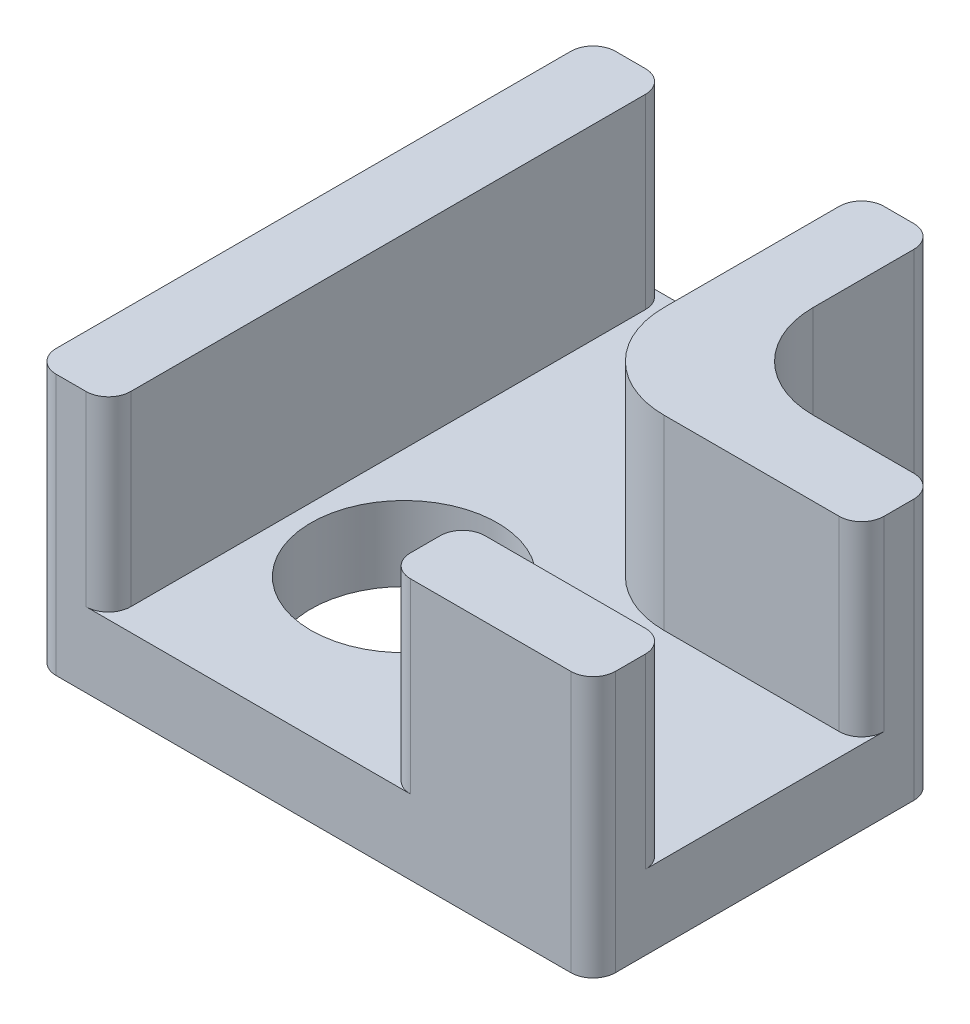
from build123d import *

# Parameters (mm, degrees)
BOSS_EXTRUDE1_DEPTH = 30.9
SHELL1_T            = -4
CUT_EXTRUDE1_REACH  = 54.486
SKETCH2_W           = 15
SKETCH2_H           = 22.9
CUT_EXTRUDE2_DEPTH  = 16.9
FILLET1_R           = 5
FILLET2_R           = 1.2
SKETCH4_R           = 5
CUT_EXTRUDE5_DEPTH  = 44.588989435


with BuildPart() as part:
    # Sketch1 → Boss-Extrude1 (new body)
    with BuildSketch(Plane(origin=(0, 0, 0), x_dir=(1, 0, 0), z_dir=(0, 1, 0))):
        Polygon((0, 0), (30, 0), (30, 18.4), (18.4, 18.4), (18.4, 30), (0, 30), align=None)
    extrude(amount=BOSS_EXTRUDE1_DEPTH)

    # Shell1
    shell1_openings = [part.faces().sort_by_distance(p)[0] for p in [
        (9.2, 15.45, -30),
        (30, 15.45, -9.2),
    ]]
    offset(amount=SHELL1_T, openings=shell1_openings, kind=Kind.INTERSECTION)

    # Sketch2 → Cut-Extrude1 (cut, up to next)
    with BuildSketch(Plane.XY, mode=Mode.PRIVATE) as cut_extrude1_sk1:
        with Locations((11.5, 15.45)):
            Rectangle(SKETCH2_W, SKETCH2_H)
    cut_extrude1_tool1 = extrude(cut_extrude1_sk1.sketch, amount=-CUT_EXTRUDE1_REACH, mode=Mode.PRIVATE) & part.part
    add(cut_extrude1_tool1.solids().sort_by_distance((11.5, 15.45, 0))[0], mode=Mode.SUBTRACT)

    # Sketch3 → Cut-Extrude2 (cut)
    with BuildSketch(Plane(origin=(0, 30.9, 0), x_dir=(1, 0, 0), z_dir=(0, 1, 0))):
        Polygon((0, 30), (0, 0), (30, 0), (30, 18.4), (18.4, 18.4), (18.4, 30), align=None)
    extrude(amount=-CUT_EXTRUDE2_DEPTH, mode=Mode.SUBTRACT)

    # Fillet1
    fillet1_edges = [part.edges().sort_by_distance(p)[0] for p in [
        (14.4, 9, -14.4),
        (18.4, 7, -18.4),
    ]]
    fillet(fillet1_edges, radius=FILLET1_R)

    # Fillet2
    fillet2_edges = [part.edges().sort_by_distance(p)[0] for p in [
        (19, 9, -4),
        (19, 9, 0),
        (14.4, 9, -30),
        (30, 9, -14.4),
        (30, 9, -4),
        (4, 9, -30),
        (4, 9, 0),
        (18.4, 7, -30),
        (30, 7, -18.4),
        (30, 7, 0),
        (0, 7, 0),
        (0, 7, -30),
    ]]
    fillet(fillet2_edges, radius=FILLET2_R)

    # Sketch4 → Cut-Extrude5 (cut, through all)
    with BuildSketch(Plane(origin=(0, 4, 0), x_dir=(1, 0, 0), z_dir=(0, 1, 0))):
        with Locations(Location((9.932233047, 9.932233047, 0), (0, 0, 270))):
            Circle(SKETCH4_R)
    extrude(amount=-CUT_EXTRUDE5_DEPTH, mode=Mode.SUBTRACT)


solid = part.part
